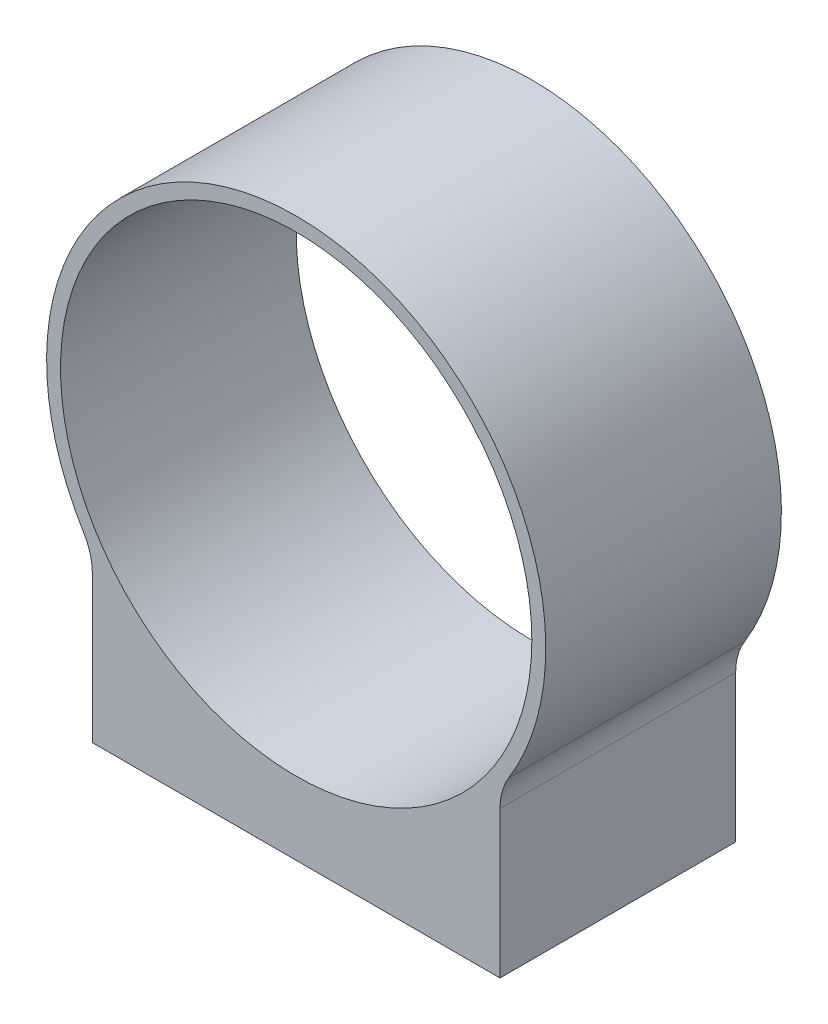
from build123d import *

# Parameters (mm, degrees)
SKETCH1_R           = 40
BOSS_EXTRUDE1_DEPTH = 40
CUT_EXTRUDE2_DEPTH  = 10
FILLET1_R           = 10


with BuildPart() as part:
    # Sketch1 → Boss-Extrude1 (new body)
    with BuildSketch(Plane.XY):
        with BuildLine():
            Line((-34.599296367, -24.44828034), (-34.599296367, -52.365409812))
            Line((-34.599296367, -52.365409812), (34.599296367, -52.365409812))
            Line((34.599296367, -52.365409812), (34.599296367, -24.44828034))
            ThreePointArc((34.599296367, -24.44828034), (0, 42.365430727), (-34.599296367, -24.44828034))
        make_face()
        Circle(SKETCH1_R, mode=Mode.SUBTRACT)
    extrude(amount=BOSS_EXTRUDE1_DEPTH)

    # Sketch4 → Cut-Extrude2 (cut)
    with BuildSketch(Plane(origin=(0, -52.365409812, 0), x_dir=(-1, 0, 0), z_dir=(0, -1, 0))):
        with BuildLine():
            ThreePointArc((8.655703751, -20), (17.299648183, -28.643944432), (25.943592616, -20))
            Line((25.943592616, -20), (8.655703751, -20))
        make_face()
        with BuildLine():
            Line((8.655703751, -20), (25.943592616, -20))
            ThreePointArc((25.943592616, -20), (17.299648183, -11.356055568), (8.655703751, -20))
        make_face()
        with BuildLine():
            ThreePointArc((-25.943592616, -20), (-17.299648183, -28.643944432), (-8.655703751, -20))
            Line((-8.655703751, -20), (-25.943592616, -20))
        make_face()
        with BuildLine():
            Line((-25.943592616, -20), (-8.655703751, -20))
            ThreePointArc((-8.655703751, -20), (-17.299648183, -11.356055568), (-25.943592616, -20))
        make_face()
    extrude(amount=-CUT_EXTRUDE2_DEPTH, mode=Mode.SUBTRACT)

    # Fillet1
    fillet1_edges = [part.edges().sort_by_distance(p)[0] for p in [
        (-34.599296367, -24.44828034, 20),
        (34.599296367, -24.44828034, 20),
    ]]
    fillet(fillet1_edges, radius=FILLET1_R)


solid = part.part
